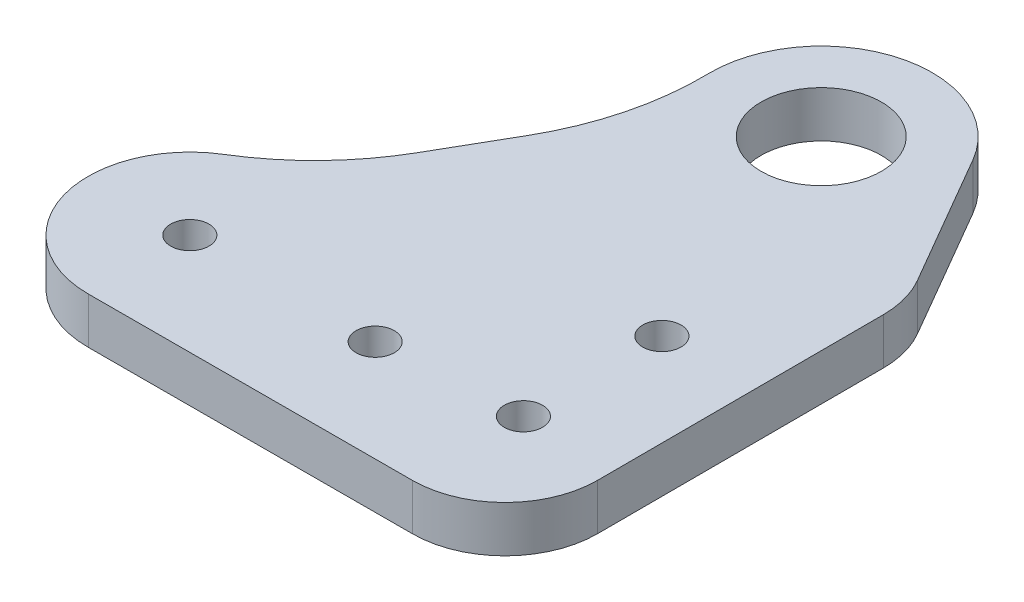
from build123d import *

# Parameters (mm, degrees)
SKETCH2_R           = 2.070000004
SKETCH2_R_2         = 2.07
SKETCH2_R_3         = 6.5
BOSS_EXTRUDE1_DEPTH = 5


with BuildPart() as part:
    # Sketch2 → Boss-Extrude1 (new body)
    with BuildSketch(Plane(origin=(0, 0, 0), x_dir=(1, 0, 0), z_dir=(0, 1, 0))):
        with BuildLine():
            Line((28.992653793, -23.747277728), (28.931209907, 7.233423459))
            ThreePointArc((28.931209907, 7.233423459), (28.585335704, 9.820933029), (27.581550122, 12.230756518))
            Line((27.581550122, 12.230756518), (19.285215447, 26.534838675))
            ThreePointArc((19.285215447, 26.534838675), (5.674768423, 32.071345418), (-3.092891515, 20.280445778))
            ThreePointArc((-3.092891515, 20.280445778), (-4.027751027, 12.242869235), (-7.076736883, 4.747518394))
            Line((-7.076736883, 4.747518394), (-11.434345304, -2.834769655))
            ThreePointArc((-11.434345304, -2.834769655), (-15.931073724, -8.794682251), (-21.760246162, -13.45964456))
            ThreePointArc((-21.760246162, -13.45964456), (-26.592719819, -25.834856698), (-15.987424791, -33.836506183))
            Line((-15.987424791, -33.836506183), (19.012506376, -33.767090977))
            ThreePointArc((19.012506376, -33.767090977), (26.077751355, -30.824140559), (28.992653793, -23.747277728))
        make_face()
        with Locations(Location((-16.009240999, -22.836527817, 0), (0, 0, 270))):
            Circle(SKETCH2_R, mode=Mode.SUBTRACT)
        with Locations(Location((3.990719669, -22.796861981, 0), (0, 0, 270))):
            Circle(SKETCH2_R_2, mode=Mode.SUBTRACT)
        with Locations(Location((18.988706877, -21.767114574, 0), (0, 0, 270))):
            Circle(SKETCH2_R_2, mode=Mode.SUBTRACT)
        with Locations(Location((18.958957503, -6.767144075, 0), (0, 0, 270))):
            Circle(SKETCH2_R_2, mode=Mode.SUBTRACT)
        with Locations(Location((8.90483079, 20.514239504, 0), (0, 0, 270))):
            Circle(SKETCH2_R_3, mode=Mode.SUBTRACT)
    extrude(amount=BOSS_EXTRUDE1_DEPTH)


solid = part.part
